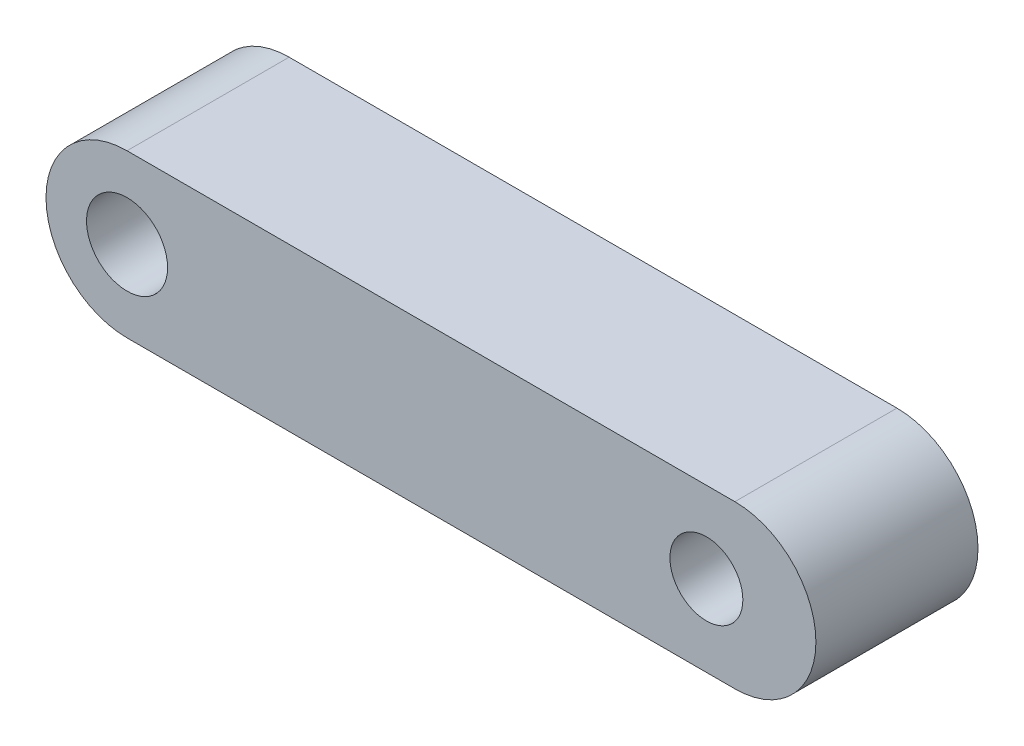
from build123d import *

# Parameters (mm, degrees)
SALIENTE_EXTRUIR1_DEPTH = 4
CROQUIS2_R              = 1
CROQUIS2_R_2            = 0.9
CORTAR_EXTRUIR1_DEPTH   = 18.710038682


with BuildPart() as part:
    # Croquis1 → Saliente-Extruir1 (new body)
    with BuildSketch(Plane.XY):
        with BuildLine():
            Line((-15.13608678, 2), (-0.13608678, 2))
            ThreePointArc((-0.13608678, 2), (1.86391322, 0), (-0.13608678, -2))
            Line((-0.13608678, -2), (-15.13608678, -2))
            ThreePointArc((-15.13608678, -2), (-17.13608678, 0), (-15.13608678, 2))
        make_face()
    extrude(amount=SALIENTE_EXTRUIR1_DEPTH)

    # Croquis2 → Cortar-Extruir1 (cut, through all)
    with BuildSketch(Plane.XY.offset(4)):
        with Locations((-15.13608678, 0)):
            Circle(CROQUIS2_R)
        with Locations((-0.839109338, 0)):
            Circle(CROQUIS2_R_2)
    extrude(amount=-CORTAR_EXTRUIR1_DEPTH, mode=Mode.SUBTRACT)


solid = part.part
